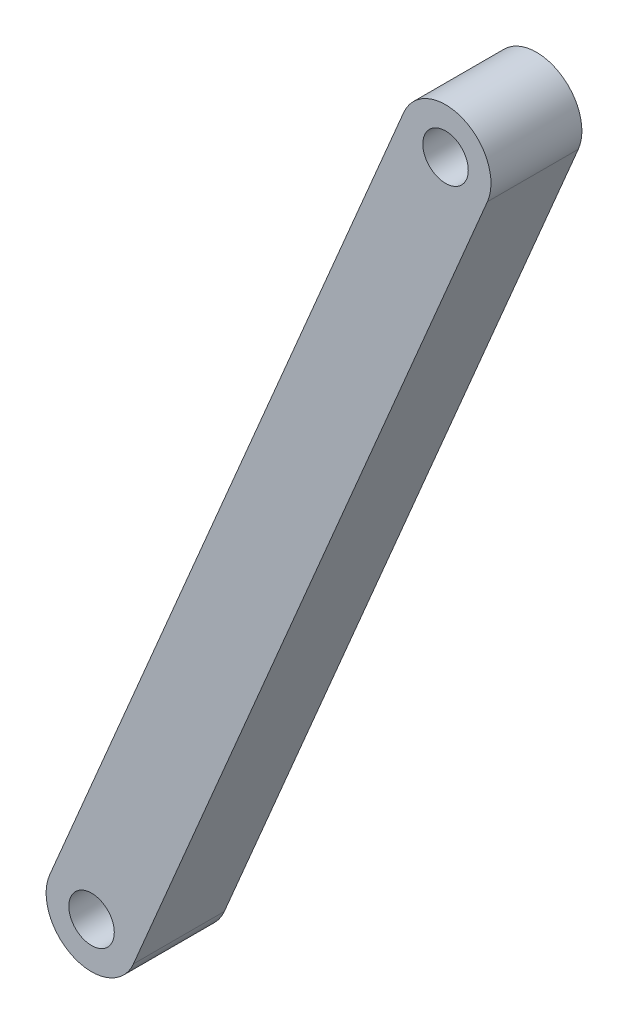
from build123d import *

# Parameters (mm, degrees)
SKETCH_1_R      = 2.5
EXTRUDE_1_DEPTH = 5


with BuildPart() as part:
    # 草图1 → 凸台-拉伸1 (new, symmetric)
    with BuildSketch(Plane.XY):
        with BuildLine():
            Line((34.447676276, 26.947376006), (73.395196405, 119.051071241))
            ThreePointArc((73.395196405, 119.051071241), (79.947757173, 121.708879996), (82.605565928, 115.156319228))
            Line((82.605565928, 115.156319228), (43.6580458, 23.052623994))
            ThreePointArc((43.6580458, 23.052623994), (37.105485032, 20.394815238), (34.447676276, 26.947376006))
        make_face()
        with Locations((78.000381166, 117.103695235)):
            Circle(SKETCH_1_R, mode=Mode.SUBTRACT)
        with Locations((39.052861038, 25)):
            Circle(SKETCH_1_R, mode=Mode.SUBTRACT)
    extrude(amount=EXTRUDE_1_DEPTH, both=True)


solid = part.part
